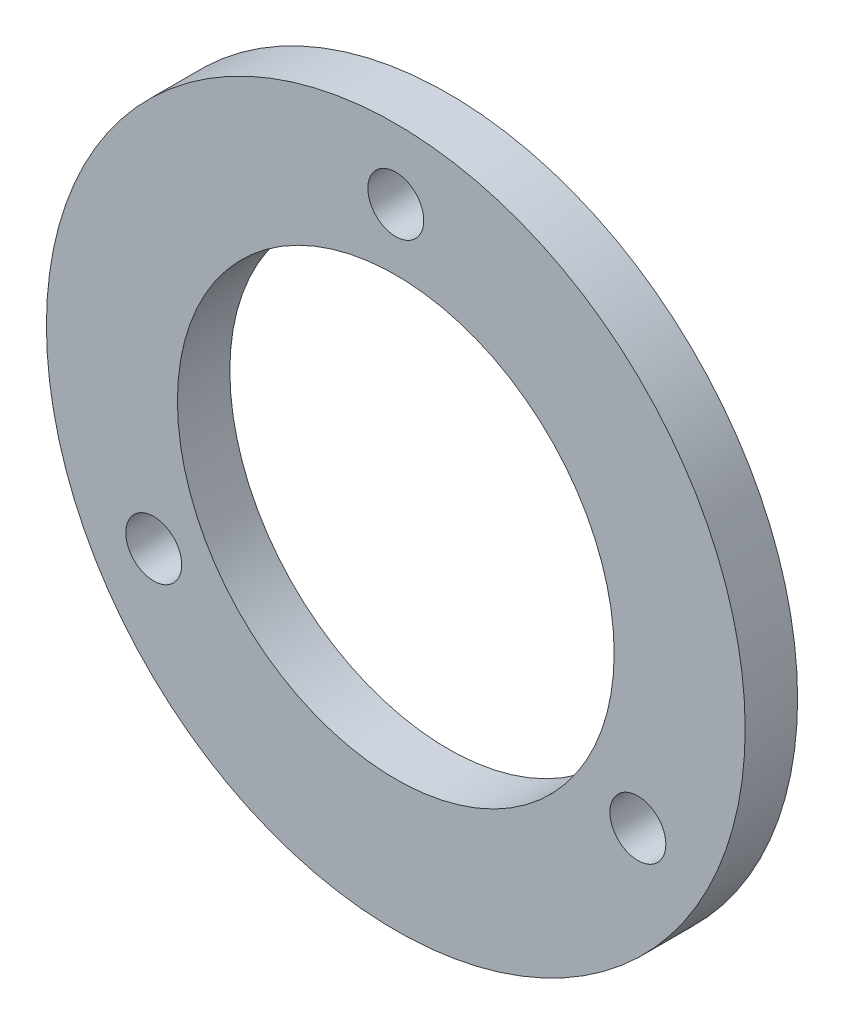
from build123d import *

# Parameters (mm, degrees)
SKETCH_1_R      = 20
SKETCH_1_R_2    = 12.5
SKETCH_1_R_3    = 1.6
EXTRUDE_1_DEPTH = 3


with BuildPart() as part:
    # 草图1 → 凸台-拉伸1 (new body)
    with BuildSketch(Plane.XY):
        with Locations((-61.285433699, -189.564945779)):
            Circle(SKETCH_1_R)
        with Locations((-61.285433699, -189.564945779)):
            Circle(SKETCH_1_R_2, mode=Mode.SUBTRACT)
        with Locations((-61.285433699, -173.564945779)):
            Circle(SKETCH_1_R_3, mode=Mode.SUBTRACT)
        with Locations((-47.429027239, -197.564945779)):
            Circle(SKETCH_1_R_3, mode=Mode.SUBTRACT)
        with Locations((-75.14184016, -197.564945779)):
            Circle(SKETCH_1_R_3, mode=Mode.SUBTRACT)
    extrude(amount=EXTRUDE_1_DEPTH)


solid = part.part
